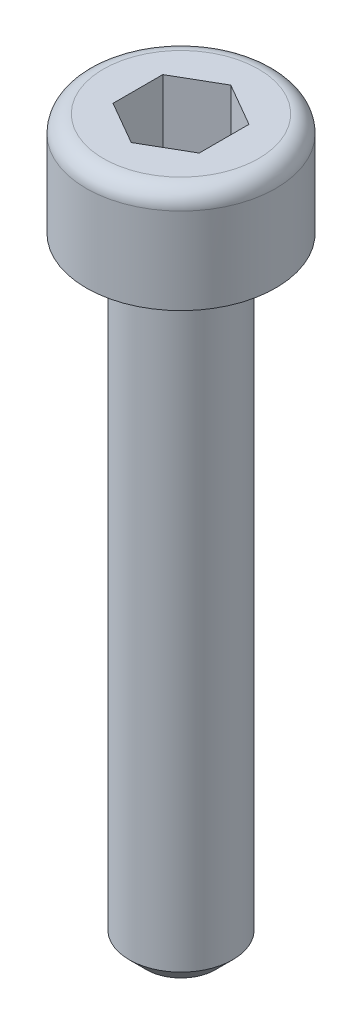
from build123d import *

# Parameters (mm, degrees)
CORTAR_EXTRUIR1_DEPTH = 2
CHAFL_N1_SIZE         = 0.5
REDONDEO1_R           = 0.5


with BuildPart() as part:
    # Croquis1 → Revolución1 (revolve)
    with BuildSketch(Plane.XY, mode=Mode.PRIVATE) as revoluci_n1_sk:
        Polygon((0, 0), (2.75, 0), (2.75, -3), (1.5, -3), (1.5, -21), (0, -21), align=None)
    revolve(revoluci_n1_sk.sketch.rotate(Axis((0, 0, 0), (0, -1, 0)), 90), axis=Axis((0, 0, 0), (0, -1, 0)))

    # Croquis2 → Cortar-Extruir1 (cut)
    with BuildSketch(Plane(origin=(0, 0, 0), x_dir=(1, 0, 0), z_dir=(0, 1, 0))):
        Polygon((1.25, 0.721687836), (0, 1.443375673), (-1.25, 0.721687836), (-1.25, -0.721687836), (0, -1.443375673), (1.25, -0.721687836), align=None)
    extrude(amount=-CORTAR_EXTRUIR1_DEPTH, mode=Mode.SUBTRACT)

    # Chaflán1
    chafl_n1_edges = [part.edges().sort_by_distance(p)[0] for p in [
        (0, -21, -1.5),
    ]]
    chamfer(chafl_n1_edges, length=CHAFL_N1_SIZE)

    # Redondeo1
    redondeo1_edges = [part.edges().sort_by_distance(p)[0] for p in [
        (0, 0, -2.75),
    ]]
    fillet(redondeo1_edges, radius=REDONDEO1_R)


solid = part.part
